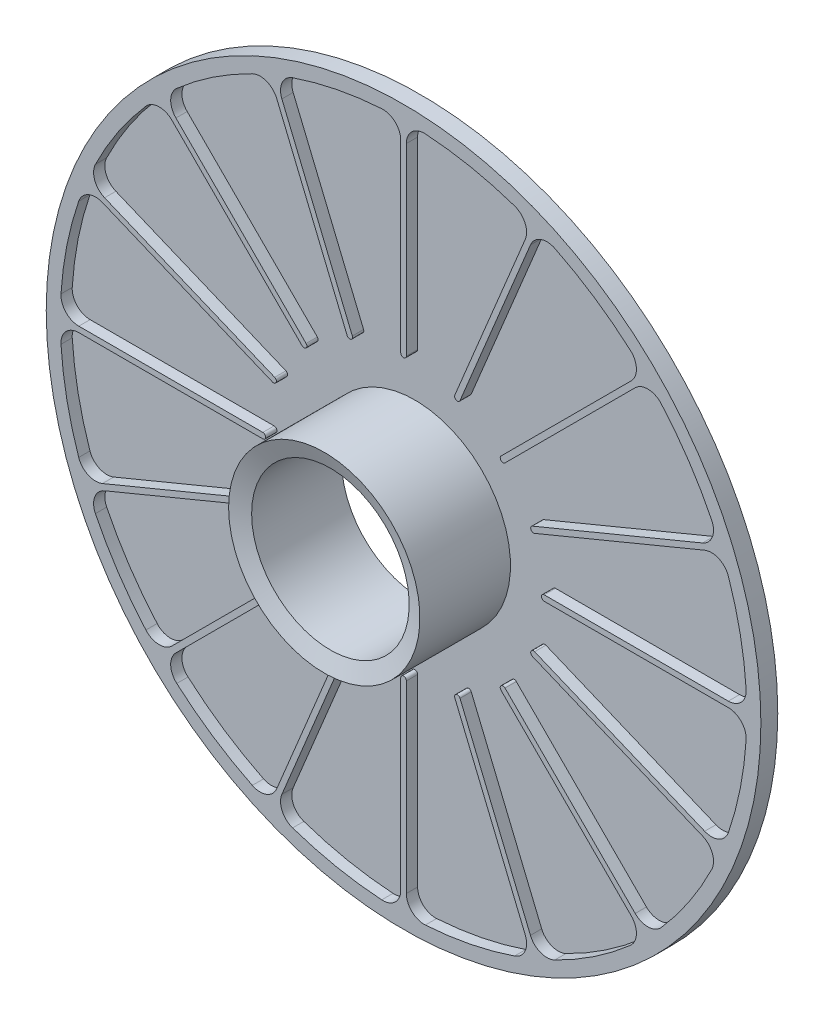
from build123d import *

# Parameters (mm, degrees)
SKETCH2_R           = 63.5
SKETCH2_R_2         = 61
BOSS_EXTRUDE1_DEPTH = 2
CIRPATTERN1_COUNT   = 16


with BuildPart() as part:
    # Sketch1 → Revolve1 (revolve)
    with BuildSketch(Plane.YZ, mode=Mode.PRIVATE) as revolve1_sk:
        Polygon((14, 0), (14, 16), (17, 17.091910703), (17, 1), (63.5, 1), (63.5, 0), align=None)
    revolve(revolve1_sk.sketch.rotate(Axis((0, 0, 0), (0, 0, 1)), 90), axis=Axis((0, 0, 0), (0, 0, 1)))

    # Sketch2 → Boss-Extrude1 (add)
    # profile 1 of 5: a face of its own
    with BuildSketch(Plane.XY.offset(1)):
        with Locations(Location((0, 0, 0), (0, 0, 180))):
            Circle(SKETCH2_R)
        Circle(SKETCH2_R_2, mode=Mode.SUBTRACT)
    # profile 2 of 5: a face of its own
    with BuildSketch(Plane.XY.offset(1)):
        with BuildLine():
            Line((-0.5, 57.708101684), (-0.5, 25))
            ThreePointArc((-0.5, 25), (-0.353553391, 24.646446609), (0, 24.5))
            Line((0, 24.5), (0, 61))
            ThreePointArc((0, 61), (-0.2500021, 60.999487694), (-0.5, 60.997950785))
            Line((-0.5, 60.997950785), (-0.5, 57.708101684))
        make_face()
    # profile 3 of 5: a face of its own
    with BuildSketch(Plane.XY.offset(1)):
        with BuildLine():
            ThreePointArc((-3.876783398, 60.876683143), (-1.502448193, 60.023408067), (-0.5, 57.708101684))
            Line((-0.5, 57.708101684), (-0.5, 60.997950785))
            ThreePointArc((-0.5, 60.997950785), (-2.189231529, 60.960702631), (-3.876783398, 60.876683143))
        make_face()
    # profile 4 of 5: a face of its own
    with BuildSketch(Plane.XY.offset(1)):
        with BuildLine():
            ThreePointArc((3.876783398, 60.876683143), (2.189231529, 60.960702631), (0.5, 60.997950785))
            Line((0.5, 60.997950785), (0.5, 57.708101684))
            ThreePointArc((0.5, 57.708101684), (1.502448193, 60.023408067), (3.876783398, 60.876683143))
        make_face()
    # profile 5 of 5: a face of its own
    with BuildSketch(Plane.XY.offset(1)):
        with BuildLine():
            Line((0, 61), (0, 24.5))
            ThreePointArc((0, 24.5), (0.353553391, 24.646446609), (0.5, 25))
            Line((0.5, 25), (0.5, 57.708101684))
            Line((0.5, 57.708101684), (0.5, 60.997950785))
            ThreePointArc((0.5, 60.997950785), (0.2500021, 60.999487694), (0, 61))
        make_face()
    boss_extrude1 = extrude(amount=BOSS_EXTRUDE1_DEPTH)

    # CirPattern1: Boss-Extrude1 ×16 about axis
    cirpattern1_axis = Axis((0, 0, 0), (0, 0, 1))
    for i in range(1, CIRPATTERN1_COUNT):
        add(boss_extrude1.rotate(cirpattern1_axis, i * 360 / CIRPATTERN1_COUNT))


solid = part.part
